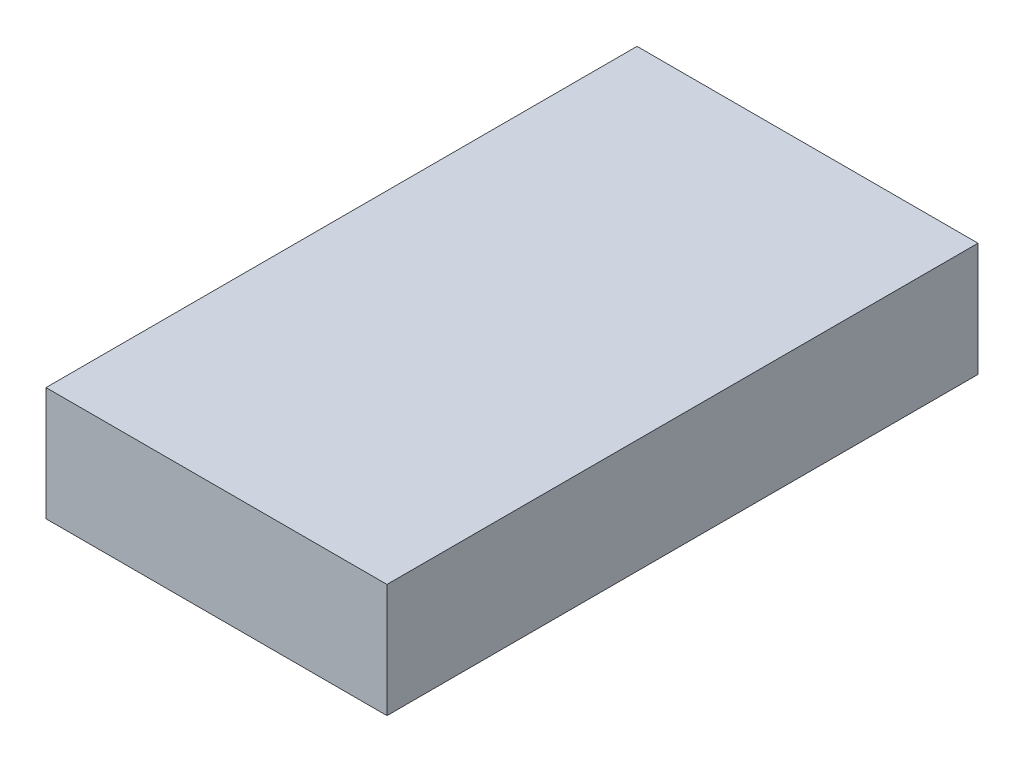
from build123d import *

# Parameters (mm, degrees)
SKETCH_1_W      = 300
SKETCH_1_H      = 520
EXTRUDE_1_DEPTH = 100


with BuildPart() as part:
    # Эскиз1 → Бобышка-Вытянуть1 (new body)
    with BuildSketch(Plane(origin=(0, 0, 0), x_dir=(1, 0, 0), z_dir=(0, 1, 0))):
        with Locations((80.435800905, 253.909749107)):
            Rectangle(SKETCH_1_W, SKETCH_1_H)
    extrude(amount=EXTRUDE_1_DEPTH)


solid = part.part
